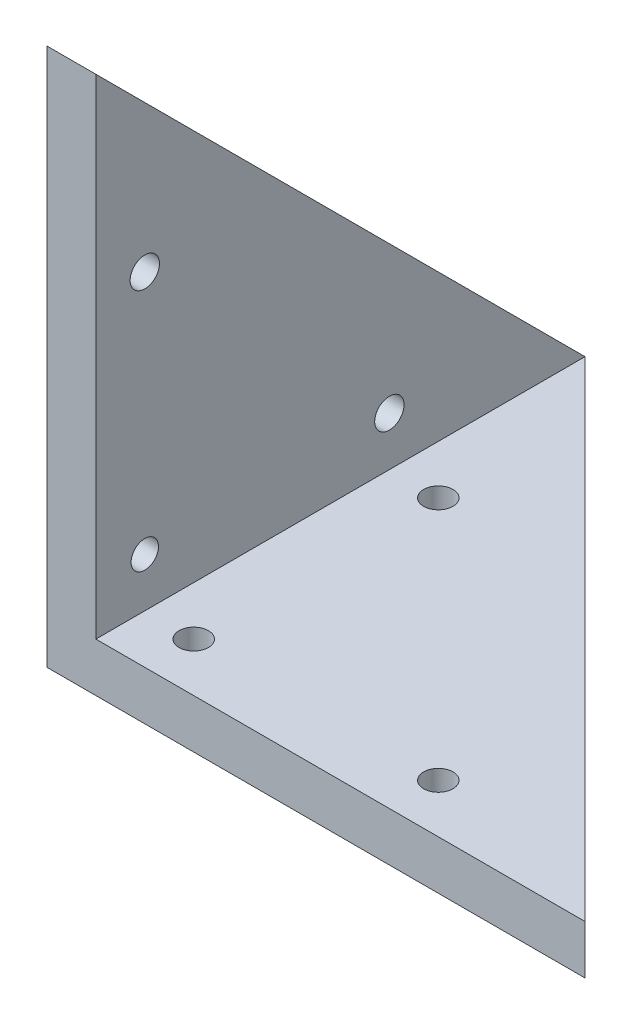
from build123d import *

# Parameters (mm, degrees)
EXTRUDE_1_DEPTH     = 5
EXTRUDE_2_DEPTH     = 5
SKETCH_4_W          = 5
SKETCH_4_H          = 5
EXTRUDE_4_DEPTH     = 50
EXTRUDE_13_DEPTH    = 5
SKETCH_8_R          = 1.5
SKETCH_8_R_2        = 1.4
CUT_EXTRUDE_1_DEPTH = 87.602540378
SKETCH_9_R          = 1.5
CUT_EXTRUDE_2_DEPTH = 87.602540378
SKETCH_10_R         = 1.5
CUT_EXTRUDE_3_DEPTH = 87.602540378
CUT_EXTRUDE_4_DEPTH = 5


with BuildPart() as part:
    # 草图1 → 凸台-拉伸1 (new body)
    with BuildSketch(Plane.XY):
        Polygon((0, 50), (50, 0), (50, -5), (-5, -5), (-5, 50), align=None)
    extrude(amount=EXTRUDE_1_DEPTH)



with BuildPart() as body_2:
    # 草图2 → 凸台-拉伸2 (new body)
    with BuildSketch(Plane(origin=(0, 0, 0), x_dir=(0, 0, -1), z_dir=(1, 0, 0))):
        Polygon((0, 0), (50, 0), (0, 50), align=None)
    extrude(amount=-EXTRUDE_2_DEPTH)

    # 草图4 → 凸台-拉伸4 (add)
    with BuildSketch(Plane.XY):
        with Locations((-2.5, -2.5)):
            Rectangle(SKETCH_4_W, SKETCH_4_H)
    extrude(amount=-EXTRUDE_4_DEPTH)


with BuildPart() as part_1:
    add(part.part)

    add(body_2.part)  # 凸台-拉伸13 merges body 2
    # 草图7 → 凸台-拉伸13 (add)
    with BuildSketch(Plane.XZ.offset(5)):
        Polygon((50, 0), (0, 0), (0, -50), align=None)
    extrude(amount=-EXTRUDE_13_DEPTH)

    # 草图8 → 切除-拉伸1 (cut, through all)
    with BuildSketch(Plane(origin=(0, 0, 0), x_dir=(0, 0, -1), z_dir=(1, 0, 0))):
        with Locations((5, 30)):
            Circle(SKETCH_8_R)
        with Locations((5, 5)):
            Circle(SKETCH_8_R_2)
        with Locations((30, 5)):
            Circle(SKETCH_8_R)
    extrude(amount=-CUT_EXTRUDE_1_DEPTH, mode=Mode.SUBTRACT)

    # 草图9 → 切除-拉伸2 (cut, through all)
    with BuildSketch(Plane(origin=(0, 0, 0), x_dir=(-1, 0, 0), z_dir=(0, 0, -1))):
        with Locations((-5, 30)):
            Circle(SKETCH_9_R)
        with Locations((-5, 5)):
            Circle(SKETCH_9_R)
        with Locations((-30, 5)):
            Circle(SKETCH_9_R)
    extrude(amount=-CUT_EXTRUDE_2_DEPTH, mode=Mode.SUBTRACT)

    # 草图10 → 切除-拉伸3 (cut, through all)
    with BuildSketch(Plane(origin=(0, 0, 0), x_dir=(1, 0, 0), z_dir=(0, 1, 0))):
        with Locations(Location((5, 30, 0), (0, 0, 270))):
            Circle(SKETCH_10_R)
        with Locations(Location((5, 5, 0), (0, 0, 270))):
            Circle(SKETCH_10_R)
        with Locations(Location((30, 5, 0), (0, 0, 270))):
            Circle(SKETCH_10_R)
    extrude(amount=-CUT_EXTRUDE_3_DEPTH, mode=Mode.SUBTRACT)

    # 草图11 → 切除-拉伸4 (cut)
    with BuildSketch(Plane.XY.offset(5)):
        Polygon((-5, 50), (-5, -5), (50, -5), (50, 0), (0, 50), align=None)
    extrude(amount=-CUT_EXTRUDE_4_DEPTH, mode=Mode.SUBTRACT)


solid = part_1.part
